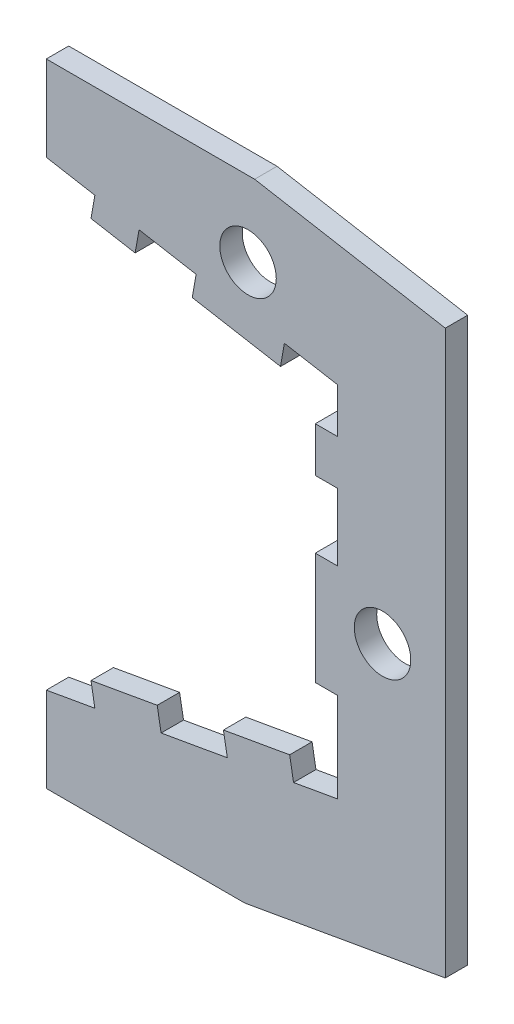
from build123d import *

# Parameters (mm, degrees)
ESQUISSE1_R             = 6.3
BOSS_EXTRU_1_DEPTH      = 5
ESQUISSE4_W             = 5
ESQUISSE4_H             = 25
ESQUISSE4_H_2           = 10
BOSS_EXTRU_2_DEPTH      = 5
ENL_V_MAT_EXTRU_1_DEPTH = 5


with BuildPart() as part:
    # Esquisse1 → Boss.-Extru.1 (new body)
    with BuildSketch(Plane.XY):
        Polygon((-65, 51.461253746), (0, 40), (0, -40), (-65, -51.461253746), (-65, -71.461253746), (-20.625899742, -71.461253746), (25, -63.416176602), (25, 63.800831685), (-18.444412366, 71.461253746), (-65, 71.461253746), align=None)
        with Locations((-20, 53.680805733)):
            Circle(ESQUISSE1_R, mode=Mode.SUBTRACT)
        with Locations(Location((10, -5, 0), (0, 0, 180))):
            Circle(ESQUISSE1_R, mode=Mode.SUBTRACT)
    extrude(amount=BOSS_EXTRU_1_DEPTH)

    # Esquisse4 → Boss.-Extru.2 (add)
    with BuildSketch(Plane.XY.offset(5)):
        with Locations((-2.5, -7.5)):
            Rectangle(ESQUISSE4_W, ESQUISSE4_H)
        Polygon((-11.888404247, 42.096246426), (-31.584559307, 45.56920998), (-32.452800195, 40.645171215), (-12.756645135, 37.172207661), align=None)
        Polygon((-9.84807753, -41.736481777), (-24.620193825, -44.341204442), (-25.488434714, -39.417165677), (-10.716318418, -36.812443012), align=None)
        with Locations((-2.5, 25)):
            Rectangle(ESQUISSE4_W, ESQUISSE4_H_2)
        Polygon((-54.164426416, -49.550649772), (-39.39231012, -46.945927107), (-40.260551009, -42.021888342), (-55.032667304, -44.626611007), align=None)
        Polygon((-44.316348886, 47.814167995), (-54.164426416, 49.550649772), (-55.032667304, 44.626611007), (-45.184589774, 42.89012923), align=None)
    extrude(amount=-BOSS_EXTRU_2_DEPTH)

    # Esquisse5 → Enlèv. mat.-Extru.1 (cut)
    with BuildSketch(Plane.XY.offset(5)):
        Polygon((-65, 70.461253746), (-18.53190103, 70.461253746), (24, 62.961732054), (24, -62.577076971), (-20.713388405, -70.461253746), (-65, -70.461253746), (-65, -77.148207451), (34.423224657, -77.148207451), (34.423224657, 88.893594993), (-65, 88.893594993), align=None)
    extrude(amount=-ENL_V_MAT_EXTRU_1_DEPTH, mode=Mode.SUBTRACT)


solid = part.part
